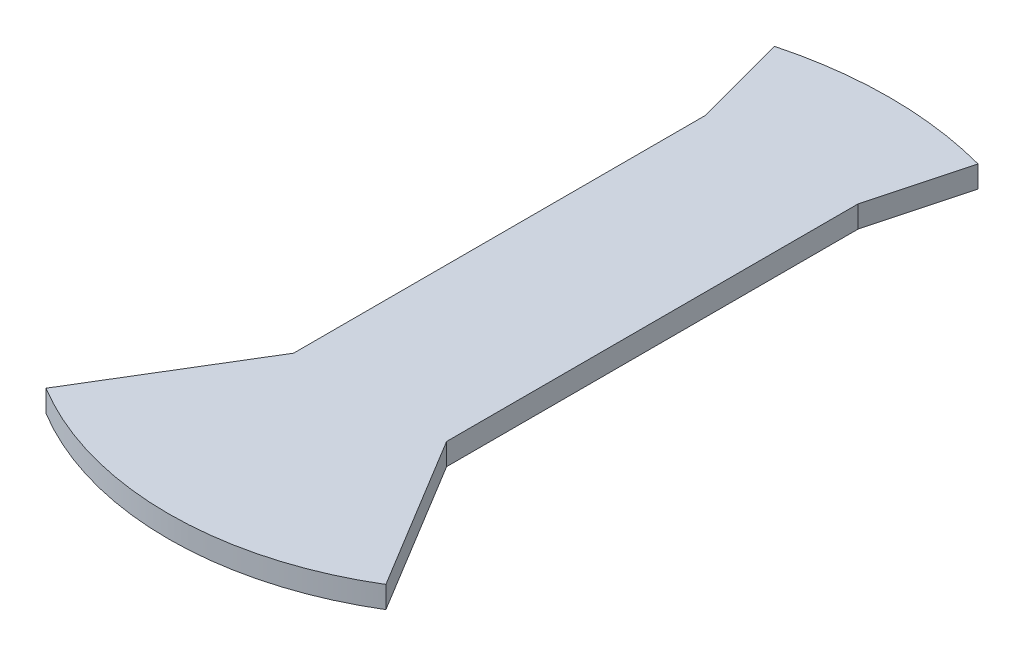
from build123d import *

# Parameters (mm, degrees)
BOSS_EXTRUDE1_DEPTH = 3.175


with BuildPart() as part:
    # Sketch1 → Boss-Extrude1 (new, symmetric)
    with BuildSketch(Plane(origin=(0, 0, 0), x_dir=(1, 0, 0), z_dir=(0, 1, 0))):
        with BuildLine():
            Line((-22.225, 82.944829198), (-22.225, -36.659057496))
            Line((-22.225, -36.659057496), (-49.38024545, -81.450315281))
            ThreePointArc((-49.38024545, -81.450315281), (0, -95.25), (49.38024545, -81.450315281))
            Line((49.38024545, -81.450315281), (22.225, -36.659057496))
            Line((22.225, -36.659057496), (22.225, 82.944829198))
            Line((22.225, 82.944829198), (29.583016855, 110.405321945))
            ThreePointArc((29.583016855, 110.405321945), (0, 114.3), (-29.583016855, 110.405321945))
            Line((-29.583016855, 110.405321945), (-22.225, 82.944829198))
        make_face()
    extrude(amount=BOSS_EXTRUDE1_DEPTH, both=True)


solid = part.part
